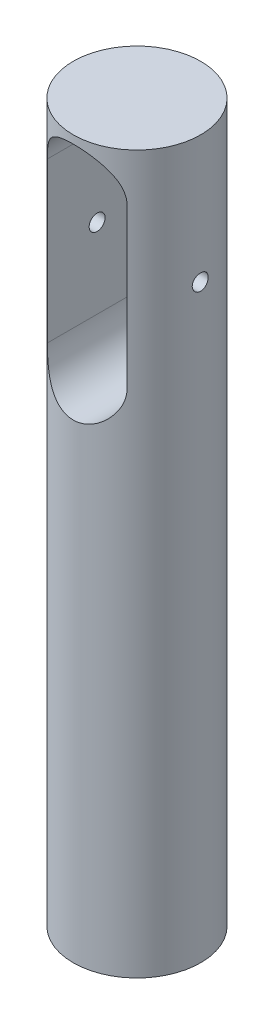
from build123d import *

# Parameters (mm, degrees)
SKETCH1_R               = 40
BOSS_EXTRUDE1_DEPTH     = 450
CUT_EXTRUDE1_DEPTH      = 454.541618818
CUT_EXTRUDE1_DEPTH_BACK = 454.541618818
CUT_EXTRUDE2_DEPTH      = 454.541618935
CUT_EXTRUDE2_DEPTH_BACK = 454.541618935
SKETCH3_R               = 5


with BuildPart() as part:
    # Sketch1 → Boss-Extrude1 (new body)
    with BuildSketch(Plane(origin=(0, 0, 0), x_dir=(1, 0, 0), z_dir=(0, 1, 0))):
        with Locations(Location((0, 0, 0), (0, 0, 270))):
            Circle(SKETCH1_R)
    extrude(amount=BOSS_EXTRUDE1_DEPTH)

    # Sketch2 → Cut-Extrude1 (cut, two sides: drawn at the far end of the back side and taken through both)
    with BuildSketch(Plane.XY.offset(-CUT_EXTRUDE1_DEPTH_BACK)):
        with BuildLine():
            Line((25, 420), (25, 320))
            ThreePointArc((25, 320), (0, 295), (-25, 320))
            Line((-25, 320), (-25, 420))
            ThreePointArc((-25, 420), (0, 445), (25, 420))
        make_face()
    extrude(amount=CUT_EXTRUDE1_DEPTH + CUT_EXTRUDE1_DEPTH_BACK, mode=Mode.SUBTRACT)

    # Sketch3 → Cut-Extrude2 (cut, two sides: drawn at the far end of the back side and taken through both)
    with BuildSketch(Plane(origin=(0, 0, 0), x_dir=(0, 0, -1), z_dir=(1, 0, 0)).offset(-CUT_EXTRUDE2_DEPTH_BACK)):
        with Locations((0, 370)):
            Circle(SKETCH3_R)
    extrude(amount=CUT_EXTRUDE2_DEPTH + CUT_EXTRUDE2_DEPTH_BACK, mode=Mode.SUBTRACT)


solid = part.part
